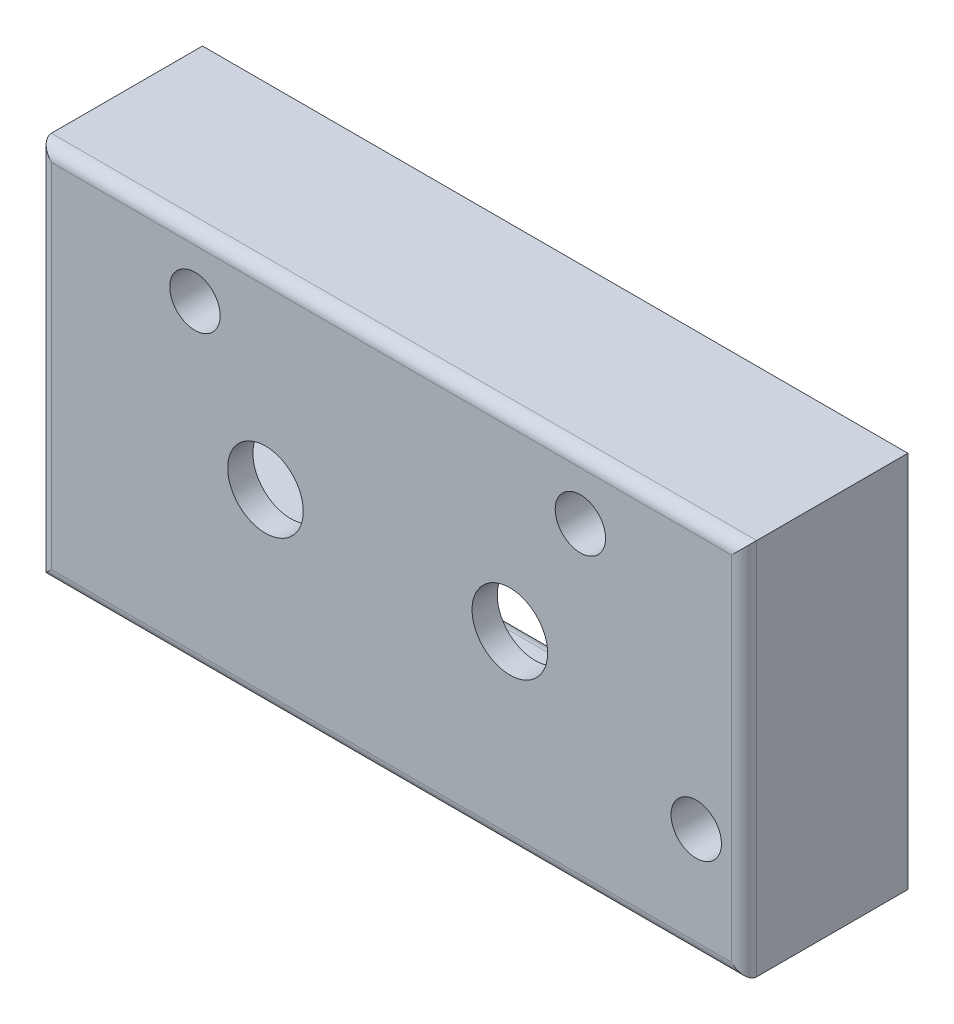
from build123d import *

# Parameters (mm, degrees)
ESBO_O1_W                = 28
ESBO_O1_H                = 15
RESSALTO_EXTRUS_O1_DEPTH = 6.5
ESBO_O2_W                = 20
ESBO_O2_H                = 5.5
CORTE_EXTRUS_O1_DEPTH    = 5.5
ESBO_O3_R                = 1
CORTE_EXTRUS_O2_DEPTH    = 18.161002302
CORTE_EXTRUS_O3_DEPTH    = 5.5
CORTE_EXTRUS_O4_DEPTH    = 5.5
ESBO_O6_W                = 2
ESBO_O6_H                = 5.5
CORTE_EXTRUS_O5_DEPTH    = 5.5
ESBO_O7_R                = 1.5
CORTE_EXTRUS_O6_DEPTH    = 5.5
FILETE1_R                = 0.5
FILETE2_R                = 0.5


with BuildPart() as part:
    # Esboço1 → Ressalto-extrusão1 (new body)
    with BuildSketch(Plane.XY):
        Rectangle(ESBO_O1_W, ESBO_O1_H)
    extrude(amount=RESSALTO_EXTRUS_O1_DEPTH)

    # Esboço2 → Corte-extrusão1 (cut)
    with BuildSketch(Plane(origin=(0, 0, 0), x_dir=(-1, 0, 0), z_dir=(0, 0, -1))):
        Rectangle(ESBO_O2_W, ESBO_O2_H)
    extrude(amount=-CORTE_EXTRUS_O1_DEPTH, mode=Mode.SUBTRACT)

    # Esboço3 → Corte-extrusão2 (cut, through all)
    with BuildSketch(Plane(origin=(0, 0, 0), x_dir=(-1, 0, 0), z_dir=(0, 0, -1))):
        with Locations((-7.5, 5.075)):
            Circle(ESBO_O3_R)
        with Locations((7.8, 5.075)):
            Circle(ESBO_O3_R)
        with Locations((-12.1, -3.125)):
            Circle(ESBO_O3_R)
    extrude(amount=-CORTE_EXTRUS_O2_DEPTH, mode=Mode.SUBTRACT)

    # Esboço4 → Corte-extrusão3 (cut)
    with BuildSketch(Plane(origin=(0, 0, 0), x_dir=(-1, 0, 0), z_dir=(0, 0, -1))):
        Polygon((0, -2.75), (-5, -2.75), (-5, -6), (5, -6), (5, -2.75), align=None)
    extrude(amount=-CORTE_EXTRUS_O3_DEPTH, mode=Mode.SUBTRACT)

    # Esboço5 → Corte-extrusão4 (cut)
    with BuildSketch(Plane(origin=(0, 0, 0), x_dir=(-1, 0, 0), z_dir=(0, 0, -1))):
        Polygon((0, 2.75), (-5, 2.75), (-5, 6), (5, 6), (5, 2.75), align=None)
    extrude(amount=-CORTE_EXTRUS_O4_DEPTH, mode=Mode.SUBTRACT)

    # Esboço6 → Corte-extrusão5 (cut)
    with BuildSketch(Plane(origin=(0, 0, 0), x_dir=(-1, 0, 0), z_dir=(0, 0, -1))):
        with Locations((11, 0)):
            Rectangle(ESBO_O6_W, ESBO_O6_H)
    extrude(amount=-CORTE_EXTRUS_O5_DEPTH, mode=Mode.SUBTRACT)

    # Esboço7 → Corte-extrusão6 (cut)
    with BuildSketch(Plane.XY.offset(6.5)):
        with Locations((-5, 0)):
            Circle(ESBO_O7_R)
        with Locations((4.7, -0.025)):
            Circle(ESBO_O7_R)
    extrude(amount=-CORTE_EXTRUS_O6_DEPTH, mode=Mode.SUBTRACT)

    # Filete1
    filete1_edges = [part.edges().sort_by_distance(p)[0] for p in [
        (-14, 0, 6.5),
        (0, -7.5, 6.5),
        (14, 0, 6.5),
        (0, 7.5, 6.5),
    ]]
    fillet(filete1_edges, radius=FILETE1_R)

    # Filete2
    filete2_edges = [part.edges().sort_by_distance(p)[0] for p in [
        (10, 0, 0),
        (7.5, -2.75, 0),
        (-8.5, 2.75, 0),
        (-8.5, -2.75, 0),
        (-5, -4.375, 0),
        (5, -4.375, 0),
        (0, -6, 0),
        (7.5, 2.75, 0),
        (-5, 4.375, 0),
        (0, 6, 0),
        (5, 4.375, 0),
        (-12, 0, 0),
    ]]
    fillet(filete2_edges, radius=FILETE2_R)


solid = part.part
